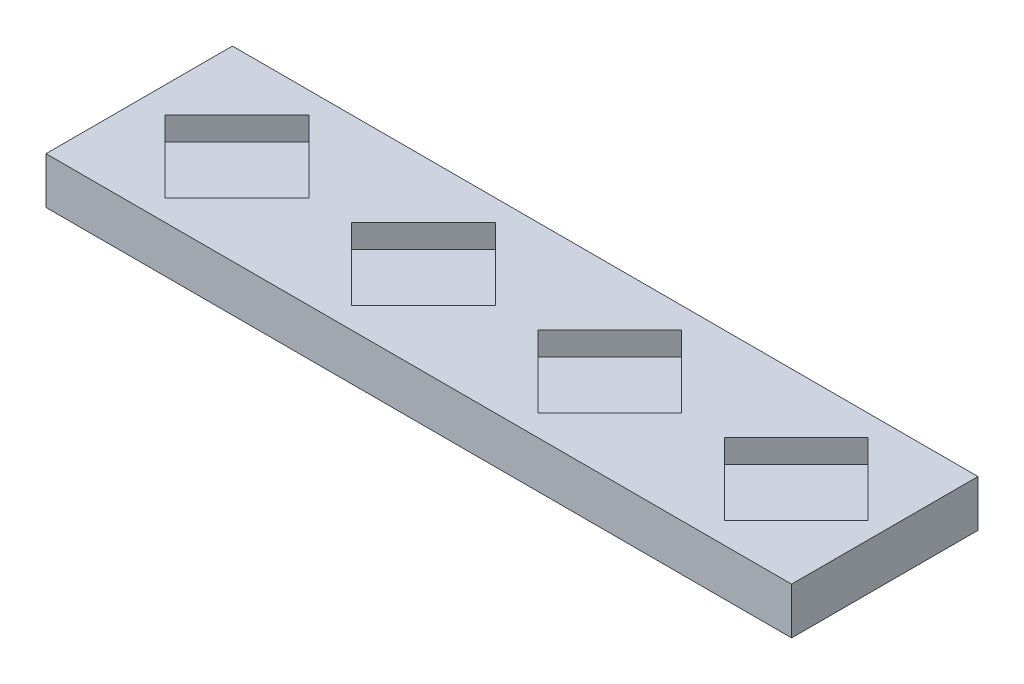
from build123d import *

# Parameters (mm, degrees)
SKETCH1_W           = 203.2
SKETCH1_H           = 50.8
BOSS_EXTRUDE1_DEPTH = 12.7
CUT_EXTRUDE6_DEPTH  = 6.35


with BuildPart() as part:
    # Sketch1 → Boss-Extrude1 (new body)
    with BuildSketch(Plane(origin=(0, 0, 0), x_dir=(1, 0, 0), z_dir=(0, 1, 0))):
        with Locations((-101.6, 25.4)):
            Rectangle(SKETCH1_W, SKETCH1_H)
    extrude(amount=BOSS_EXTRUDE1_DEPTH)

    # Sketch2 → Cut-Extrude6 (cut)
    with BuildSketch(Plane(origin=(0, 12.7, 0), x_dir=(1, 0, 0), z_dir=(0, 1, 0))):
        Polygon((-176.534655494, 5.825201554), (-156.959857048, 25.4), (-176.534655494, 44.974798446), (-196.10945394, 25.4), align=None)
        Polygon((-125.734655494, 5.825201554), (-106.159857048, 25.4), (-125.734655494, 44.974798446), (-145.30945394, 25.4), align=None)
        Polygon((-74.934655494, 5.825201554), (-55.359857048, 25.4), (-74.934655494, 44.974798446), (-94.50945394, 25.4), align=None)
        Polygon((-24.134655494, 5.825201554), (-4.559857048, 25.4), (-24.134655494, 44.974798446), (-43.70945394, 25.4), align=None)
    extrude(amount=-CUT_EXTRUDE6_DEPTH, mode=Mode.SUBTRACT)


solid = part.part
